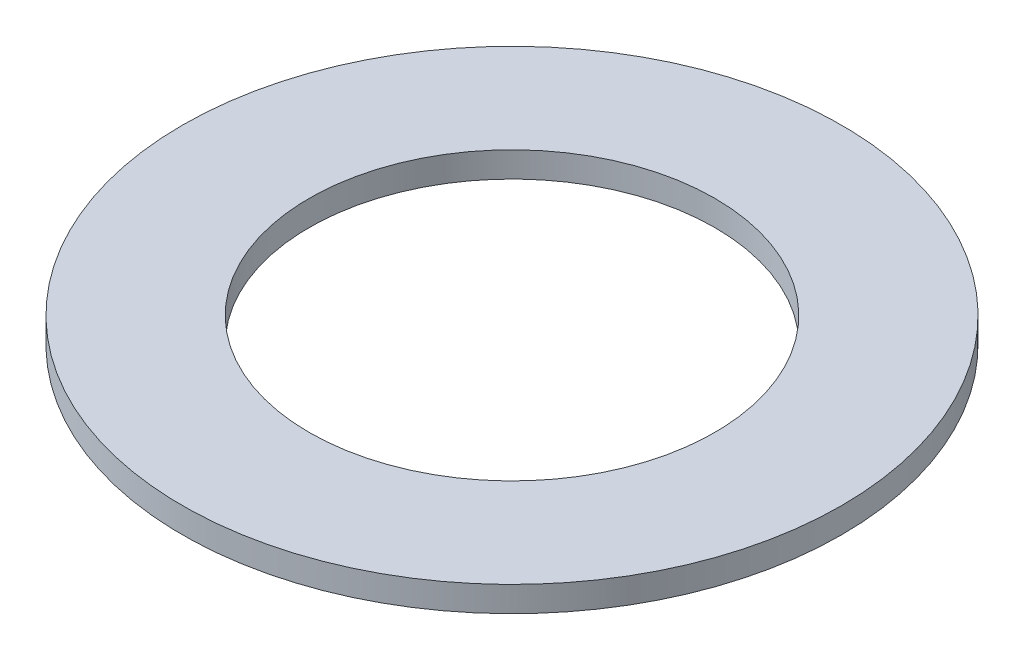
from build123d import *

# Parameters (mm, degrees)
SKETCH1_R           = 13
SKETCH1_R_2         = 8
EXTRUDE_THIN1_DEPTH = 1


with BuildPart() as part:
    # Sketch1 → Extrude-Thin1 (new body)
    with BuildSketch(Plane(origin=(0, 0, 0), x_dir=(1, 0, 0), z_dir=(0, 1, 0))):
        Circle(SKETCH1_R)
        Circle(SKETCH1_R_2, mode=Mode.SUBTRACT)
    extrude(amount=EXTRUDE_THIN1_DEPTH)


solid = part.part
